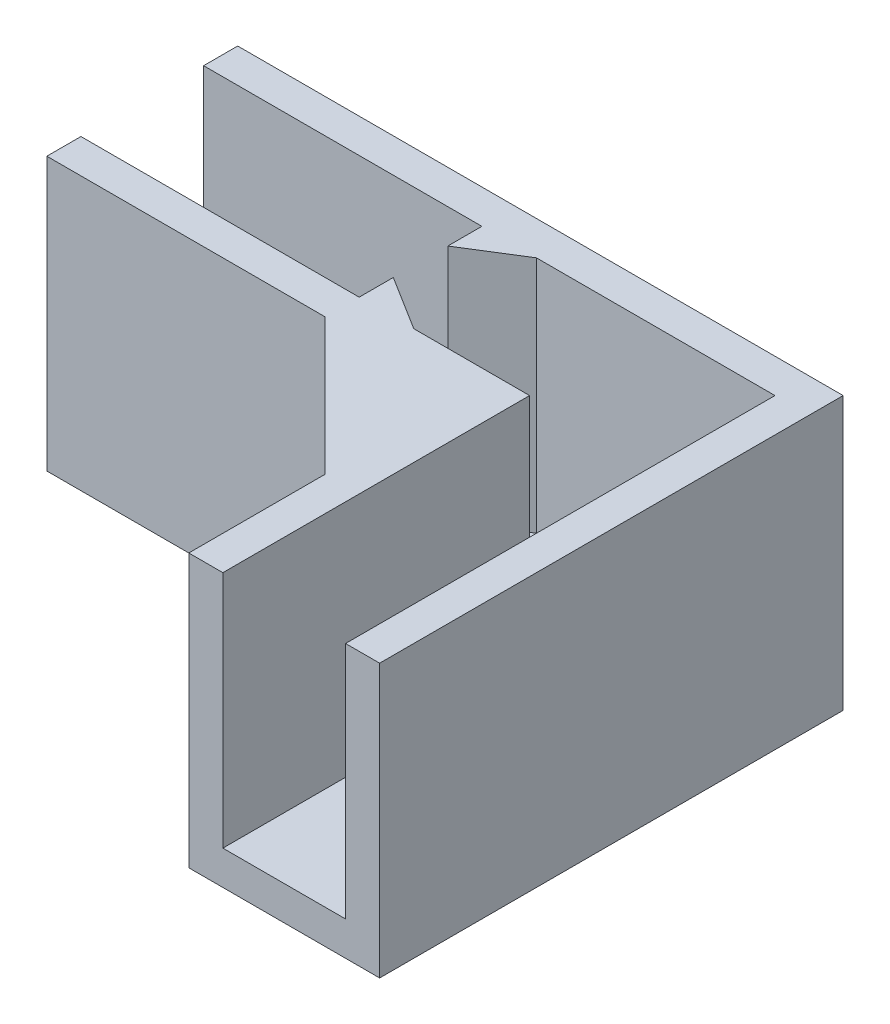
from build123d import *

# Parameters (mm, degrees)
SALIENTE_EXTRUIR1_DEPTH = 40
CORTAR_EXTRUIR1_DEPTH   = 35
SALIENTE_EXTRUIR2_DEPTH = 40


with BuildPart() as part:
    # Croquis1 → Saliente-Extruir1 (new body)
    with BuildSketch(Plane(origin=(0, 0, 0), x_dir=(1, 0, 0), z_dir=(0, 1, 0))):
        Polygon((14, -14), (14, 14), (-14, 14), (-74.822534414, 14), (-74.822534414, -14), (-14, -14), (-14, -54), (14, -54), align=None)
    extrude(amount=SALIENTE_EXTRUIR1_DEPTH)

    # Croquis2 → Cortar-Extruir1 (cut)
    with BuildSketch(Plane(origin=(0, 40, 0), x_dir=(1, 0, 0), z_dir=(0, 1, 0))):
        Polygon((9, 9), (-9, 9), (-74.822534414, 9), (-74.822534414, -9), (-9, -9), (-9, -54), (9, -54), (9, -9), align=None)
    extrude(amount=-CORTAR_EXTRUIR1_DEPTH, mode=Mode.SUBTRACT)

    # Croquis3 → Saliente-Extruir2 (add)
    with BuildSketch(Plane(origin=(0, 40, 0), x_dir=(1, 0, 0), z_dir=(0, 1, 0))):
        Polygon((-34, -14), (-14, -34), (-14, -14), align=None)
        Polygon((-34, -9), (-34, -4), (-26, -9), align=None)
        Polygon((-34, 4), (-26, 9), (-34, 9), align=None)
    extrude(amount=-SALIENTE_EXTRUIR2_DEPTH)


solid = part.part
